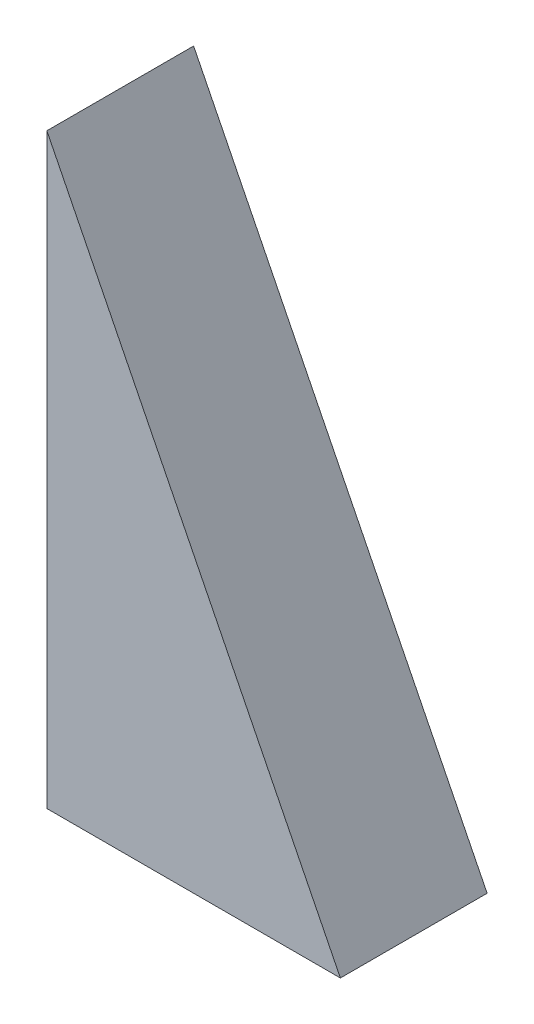
from build123d import *

# Parameters (mm, degrees)
BOSS_EXTRUDE1_DEPTH = 10


with BuildPart() as part:
    # Sketch1 → Boss-Extrude1 (new body)
    with BuildSketch(Plane.XY):
        Polygon((0, 0), (0, 40), (20, 0), align=None)
    extrude(amount=BOSS_EXTRUDE1_DEPTH)


solid = part.part
